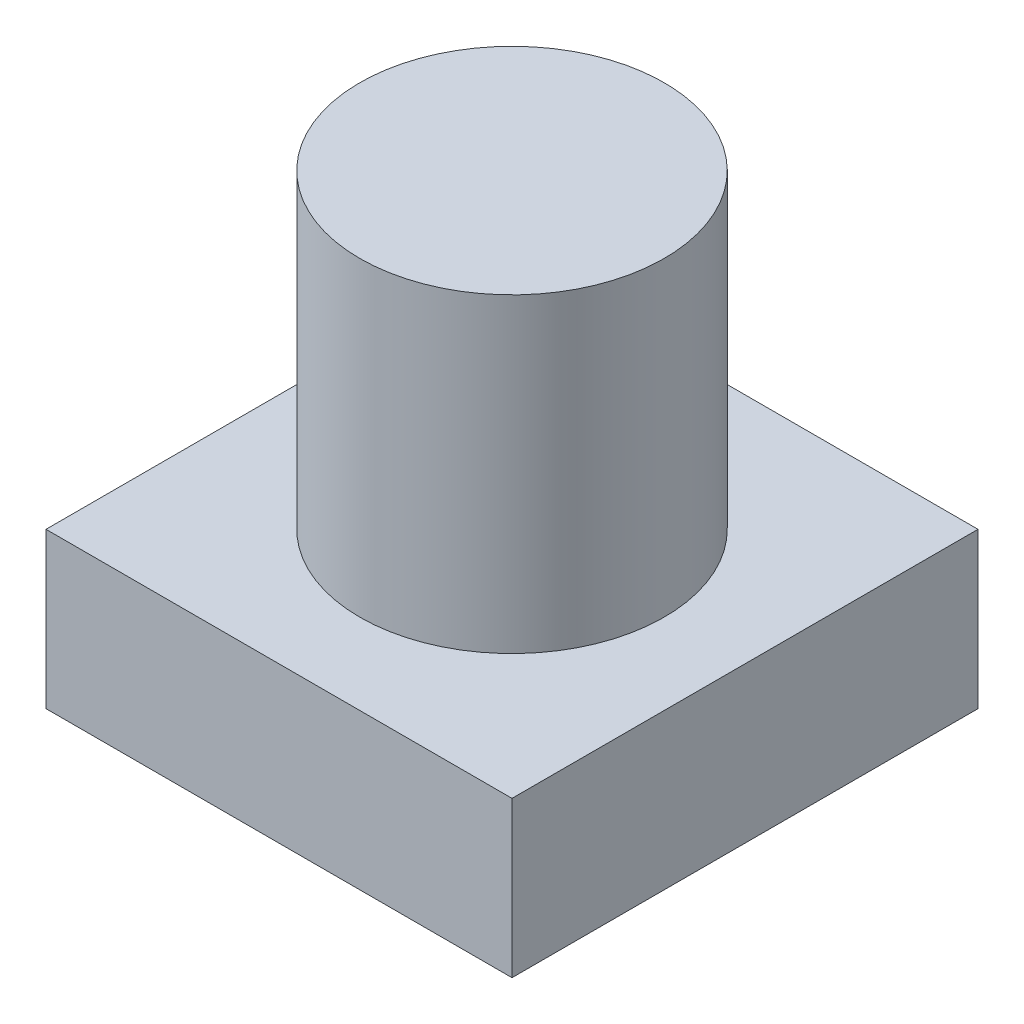
from build123d import *

# Parameters (mm, degrees)
SKETCH1_W           = 15
SKETCH1_H           = 15
BOSS_EXTRUDE1_DEPTH = 5
SKETCH2_R           = 4.9
BOSS_EXTRUDE2_DEPTH = 10


with BuildPart() as part:
    # Sketch1 → Boss-Extrude1 (new body)
    with BuildSketch(Plane(origin=(0, 0, 0), x_dir=(1, 0, 0), z_dir=(0, 1, 0))):
        Rectangle(SKETCH1_W, SKETCH1_H)
    extrude(amount=BOSS_EXTRUDE1_DEPTH)

    # Sketch2 → Boss-Extrude2 (add)
    with BuildSketch(Plane(origin=(0, 5, 0), x_dir=(1, 0, 0), z_dir=(0, 1, 0))):
        with Locations(Location((0, 0, 0), (0, 0, 270))):
            Circle(SKETCH2_R)
    extrude(amount=BOSS_EXTRUDE2_DEPTH)


solid = part.part
